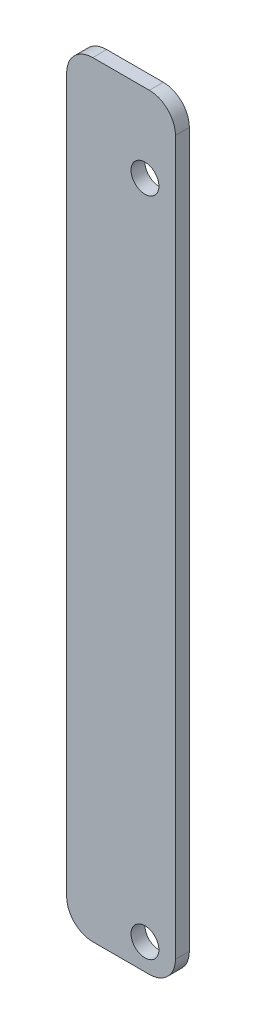
from build123d import *

# Parameters (mm, degrees)
SKETCH2_W                      = 12.5
SKETCH2_H                      = 88
BOSS_EXTRUDE1_DEPTH            = 1.6
F_3_2_3_2_DIAMETER_HOLE1_D     = 3.2
F_3_2_3_2_DIAMETER_HOLE1_DEPTH = 1.6
F_3_2_3_2_DIAMETER_HOLE1_TIP   = 0.96137699
FILLET1_R                      = 3


with BuildPart() as part:
    # Sketch2 → Boss-Extrude1 (new body)
    with BuildSketch(Plane.XY.offset(96.838346843)):
        with Locations((-53.102520427, -5.981220417)):
            Rectangle(SKETCH2_W, SKETCH2_H)
    extrude(amount=BOSS_EXTRUDE1_DEPTH)

    # Ø3.2 (3.2) Diameter Hole1
    with Locations(Plane.XY.offset(98.438346843)):
        with Locations((-50.352520427, 29.018779583), (-50.352520427, -46.981220417)):
            Hole(F_3_2_3_2_DIAMETER_HOLE1_D / 2, depth=F_3_2_3_2_DIAMETER_HOLE1_DEPTH)
            with Locations((0, 0, -(F_3_2_3_2_DIAMETER_HOLE1_DEPTH + F_3_2_3_2_DIAMETER_HOLE1_TIP / 2))):  # 118° drill point
                Cone(0, F_3_2_3_2_DIAMETER_HOLE1_D / 2, F_3_2_3_2_DIAMETER_HOLE1_TIP, mode=Mode.SUBTRACT)

    # Fillet1
    fillet1_edges = [part.edges().sort_by_distance(p)[0] for p in [
        (-46.852520427, -49.981220417, 97.638346843),
        (-59.352520427, -49.981220417, 97.638346843),
        (-59.352520427, 38.018779583, 97.638346843),
        (-46.852520427, 38.018779583, 97.638346843),
    ]]
    fillet(fillet1_edges, radius=FILLET1_R)


solid = part.part
